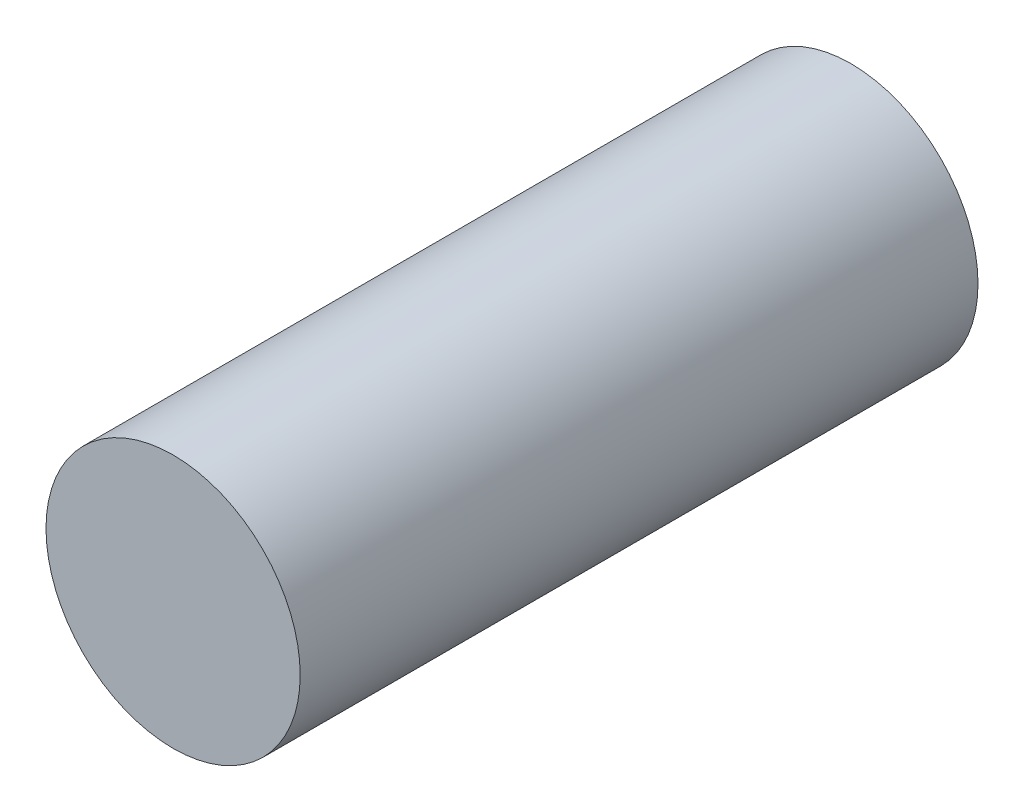
from build123d import *

# Parameters (mm, degrees)
SKETCH_1_R      = 150
EXTRUDE_1_DEPTH = 800


with BuildPart() as part:
    # 草图1 → 凸台-拉伸1 (new body)
    with BuildSketch(Plane.XY):
        Circle(SKETCH_1_R)
    extrude(amount=EXTRUDE_1_DEPTH)


solid = part.part
